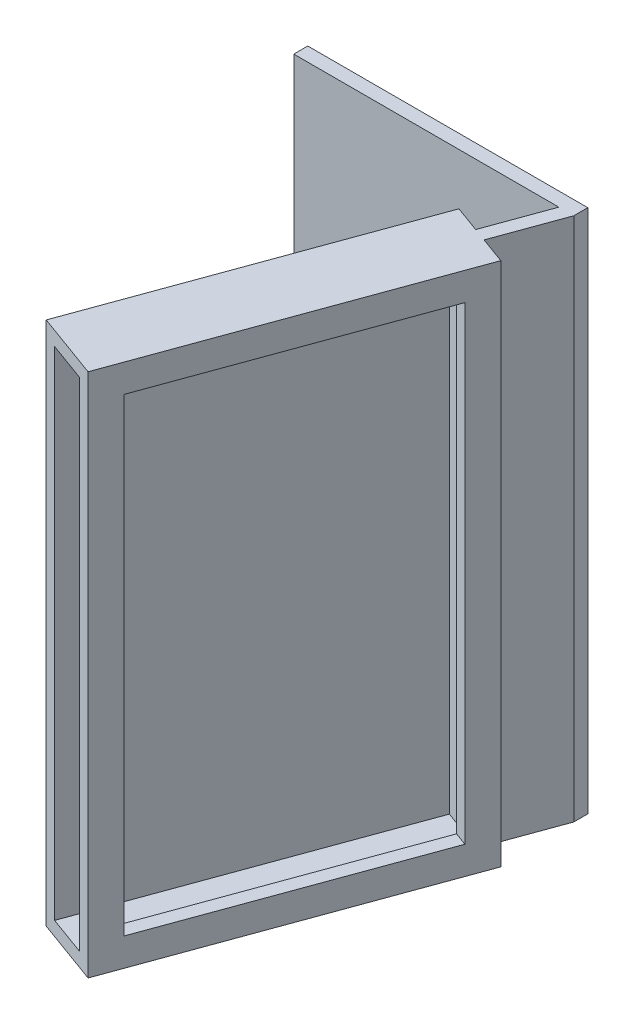
from build123d import *

# Parameters (mm, degrees)
SKETCH1_W           = 95.25
SKETCH1_H           = 50.8
BOSS_EXTRUDE1_DEPTH = 2.54
BOSS_EXTRUDE2_DEPTH = 95.25
SKETCH3_W           = 12.7
SKETCH3_H           = 95.25
BOSS_EXTRUDE3_DEPTH = 2.54
SKETCH4_W           = 12.7
SKETCH4_H           = 95.25
SKETCH4_W_2         = 7.62
SKETCH4_H_2         = 90.17
BOSS_EXTRUDE4_DEPTH = 55.88
CUT_EXTRUDE1_REACH  = 132.474
SKETCH5_W           = 85.09
SKETCH5_H           = 48.26


with BuildPart() as part:
    # Sketch1 → Boss-Extrude1 (new body)
    with BuildSketch(Plane(origin=(0, 0, 0), x_dir=(0, 1, 0), z_dir=(0, 0, 1))):
        with Locations((47.625, 25.4)):
            Rectangle(SKETCH1_W, SKETCH1_H)
    extrude(amount=BOSS_EXTRUDE1_DEPTH)

    # Sketch2 → Boss-Extrude2 (add)
    with BuildSketch(Plane(origin=(0, 95.25, 0), x_dir=(-1, 0, 0), z_dir=(0, 1, 0))):
        Polygon((0, 2.54), (4.34365582, 14.474096284), (6.730475077, 13.60536512), (2.703011542, 2.54), align=None)
    extrude(amount=-BOSS_EXTRUDE2_DEPTH)

    # Sketch3 → Boss-Extrude3 (add)
    with BuildSketch(Plane(origin=(-5.159996085, 0, 14.176972727), x_dir=(0.9396926207859077, 0, 0.34202014332567104), z_dir=(-0.34202014332567104, 0, 0.9396926207859077))):
        with Locations((-0.401268836, 47.625)):
            Rectangle(SKETCH3_W, SKETCH3_H)
    extrude(amount=BOSS_EXTRUDE3_DEPTH)

    # Sketch4 → Boss-Extrude4 (add)
    with BuildSketch(Plane(origin=(-6.028727249, 0, 16.563791984), x_dir=(0.9396926207859075, 0, 0.3420201433256711), z_dir=(-0.3420201433256711, 0, 0.9396926207859075))):
        with Locations((-0.401268836, 47.625)):
            Rectangle(SKETCH4_W, SKETCH4_H)
        with Locations((-0.401268836, 47.625)):
            Rectangle(SKETCH4_W_2, SKETCH4_H_2, mode=Mode.SUBTRACT)
    extrude(amount=BOSS_EXTRUDE4_DEPTH)

    # Sketch5 → Cut-Extrude1 (cut, up to next)
    with BuildSketch(Plane(origin=(5.589978778, 0, 2.034585885), x_dir=(0, 1, 0), z_dir=(0.9396926207859075, 0, 0.3420201433256711)), mode=Mode.PRIVATE) as cut_extrude1_sk1:
        with Locations((47.625, 44.296819257)):
            Rectangle(SKETCH5_W, SKETCH5_H)
    cut_extrude1_tool1 = extrude(cut_extrude1_sk1.sketch, amount=-CUT_EXTRUDE1_REACH, mode=Mode.PRIVATE) & part.part
    add(cut_extrude1_tool1.solids().sort_by_distance((-9.560426, 47.625, 43.65998))[0], mode=Mode.SUBTRACT)


solid = part.part
